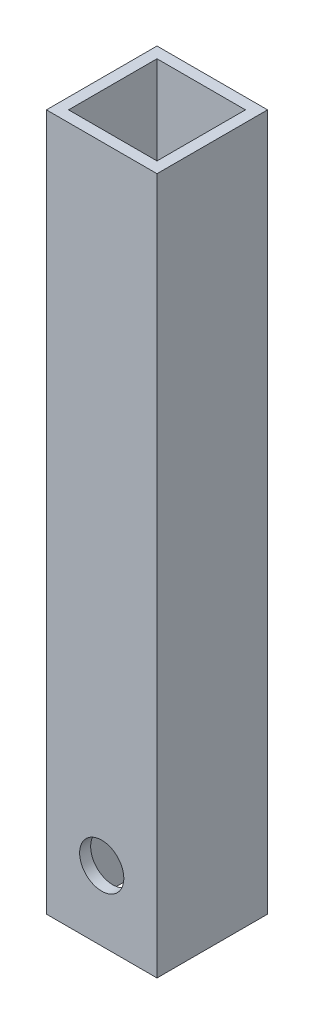
from build123d import *

# Parameters (mm, degrees)
SKETCH1_W               = 3.96875
SKETCH1_H               = 3.96875
BOSS_EXTRUDE1_DEPTH     = 12.5
SKETCH2_W               = 3.175
SKETCH2_H               = 3.175
CUT_EXTRUDE1_DEPTH      = 26.157016681
CUT_EXTRUDE2_DEPTH      = 13.811147032
CUT_EXTRUDE2_DEPTH_BACK = 13.811147032
SKETCH3_R               = 0.79375


with BuildPart() as part:
    # Sketch1 → Boss-Extrude1 (new, symmetric)
    with BuildSketch(Plane(origin=(0, 0, 0), x_dir=(1, 0, 0), z_dir=(0, 1, 0))):
        Rectangle(SKETCH1_W, SKETCH1_H)
    extrude(amount=BOSS_EXTRUDE1_DEPTH, both=True)

    # Sketch2 → Cut-Extrude1 (cut, through all)
    with BuildSketch(Plane(origin=(0, 12.5, 0), x_dir=(1, 0, 0), z_dir=(0, 1, 0))):
        Rectangle(SKETCH2_W, SKETCH2_H)
    extrude(amount=-CUT_EXTRUDE1_DEPTH, mode=Mode.SUBTRACT)

    # Sketch3 → Cut-Extrude2 (cut, two sides: drawn at the far end of the back side and taken through both)
    with BuildSketch(Plane.XY.offset(-CUT_EXTRUDE2_DEPTH_BACK)):
        with Locations((0, -10)):
            Circle(SKETCH3_R)
    extrude(amount=CUT_EXTRUDE2_DEPTH + CUT_EXTRUDE2_DEPTH_BACK, mode=Mode.SUBTRACT)


solid = part.part
